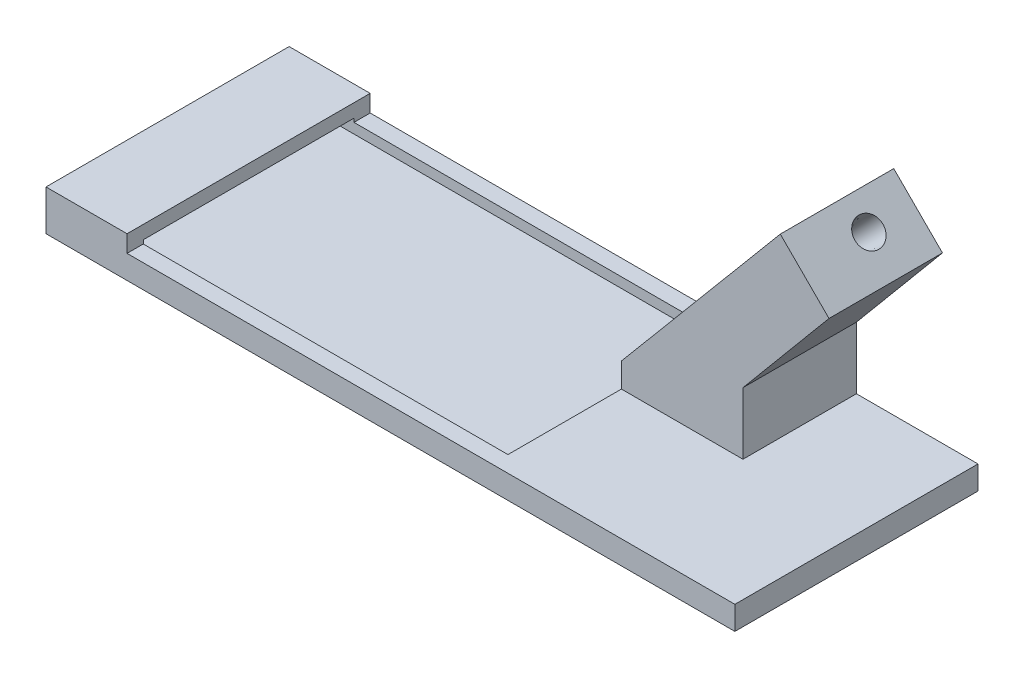
from build123d import *

# Parameters (mm, degrees)
SKETCH1_W           = 85
SKETCH1_H           = 30
BOSS_EXTRUDE1_DEPTH = 5
SKETCH2_W           = 26
SKETCH2_H           = 1.7
CUT_EXTRUDE1_DEPTH  = 55
SKETCH3_W           = 75
SKETCH3_H           = 30
CUT_EXTRUDE2_DEPTH  = 2.1
BOSS_EXTRUDE5_DEPTH = 14


with BuildPart() as part:
    # Sketch1 → Boss-Extrude1 (new body)
    with BuildSketch(Plane(origin=(0, 0, 0), x_dir=(1, 0, 0), z_dir=(0, 1, 0))):
        Rectangle(SKETCH1_W, SKETCH1_H)
    extrude(amount=BOSS_EXTRUDE1_DEPTH)

    # Sketch2 → Cut-Extrude1 (cut)
    with BuildSketch(Plane.ZY.offset(42.5)):
        with Locations((0, 2.5)):
            Rectangle(SKETCH2_W, SKETCH2_H)
    extrude(amount=-CUT_EXTRUDE1_DEPTH, mode=Mode.SUBTRACT)

    # Sketch3 → Cut-Extrude2 (cut)
    with BuildSketch(Plane(origin=(0, 5, 0), x_dir=(1, 0, 0), z_dir=(0, 1, 0))):
        with Locations((5, 0)):
            Rectangle(SKETCH3_W, SKETCH3_H)
    extrude(amount=-CUT_EXTRUDE2_DEPTH, mode=Mode.SUBTRACT)

    # Sketch10 → Boss-Extrude5 (add)
    with BuildSketch(Plane(origin=(0, 0, -15), x_dir=(-1, 0, 0), z_dir=(0, 0, -1))):
        Polygon((-27.5, 2.9), (-12.5, 2.9), (-12.5, 5.9), (-32.105022095, 29.264355515), (-38.115429736, 23.253947875), (-27.5, 10.552651361), align=None)
    extrude(amount=-BOSS_EXTRUDE5_DEPTH)

    # Sketch14 → Cut-Revolve5 (revolve, cut)
    with BuildSketch(Plane(origin=(4.05, -4.05, 0), x_dir=(0, 0, 1), z_dir=(-0.7071067811865432, 0.7071067811865518, 0)), mode=Mode.PRIVATE) as cut_revolve5_sk:
        Polygon((-9.8, 10.005560954), (-9.2, 10.005560954), (-9.3, 43.905413461), (-11.05, 43.905413461), align=None)
    revolve(cut_revolve5_sk.sketch.rotate(Axis((11.125, 3.025, -9.2), (0.7071037046891342, 0.7071037046891259, -0.0029498525073746134)), 89.830986391), axis=Axis((11.125, 3.025, -9.2), (0.7071037046891342, 0.7071037046891259, -0.0029498525073746134)), mode=Mode.SUBTRACT)


solid = part.part
